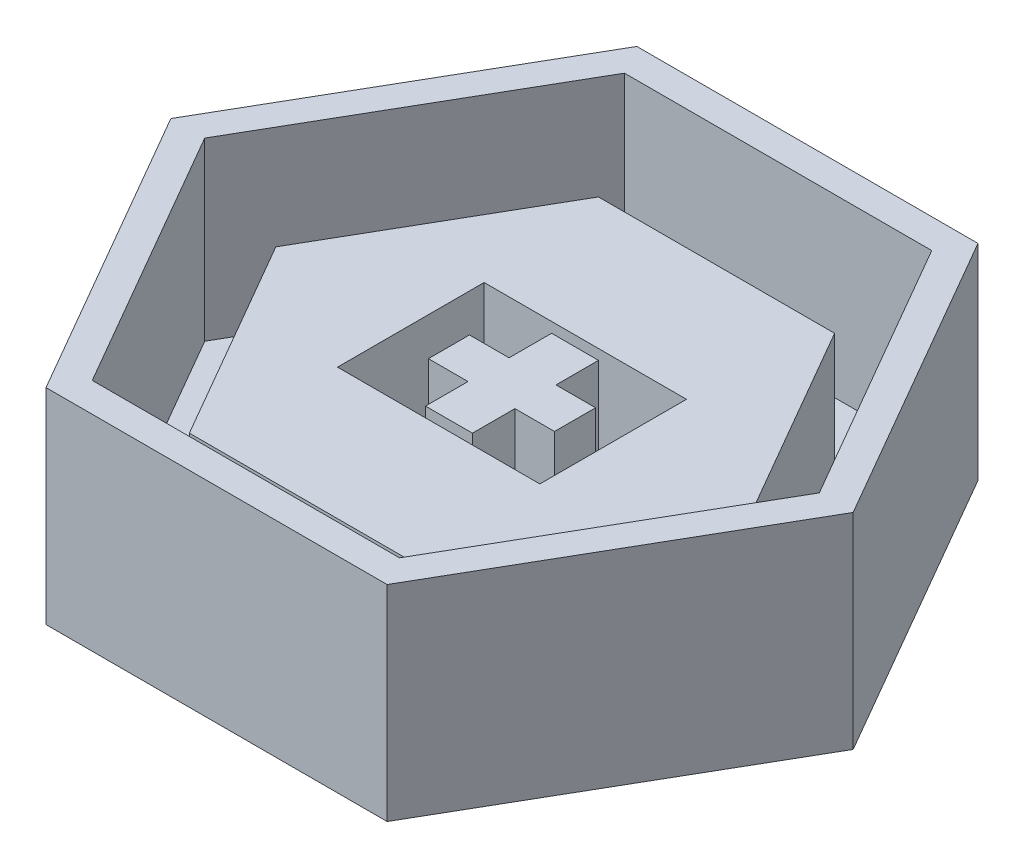
from build123d import *

# Parameters (mm, degrees)
CROSS_DEPTH         = 4
BOTTOM_DEPTH        = 1
WALLS_DEPTH         = 1
WALLS_DEPTH_BACK    = 6
SKETCH5_W           = 6.9
SKETCH5_H           = 5
BOSS_EXTRUDE4_DEPTH = 4


with BuildPart() as part:
    # Sketch1 → Cross (new body)
    with BuildSketch(Plane(origin=(0, 0, 0), x_dir=(1, 0, 0), z_dir=(0, 1, 0))):
        Polygon((-0.8, 2.15), (0.8, 2.15), (0.8, 0.7), (2.15, 0.7), (2.15, -0.7), (0.8, -0.7), (0.8, -2.15), (-0.8, -2.15), (-0.8, -0.7), (-2.15, -0.7), (-2.15, 0.7), (-0.8, 0.7), align=None)
    extrude(amount=CROSS_DEPTH)

    # Sketch3 → Bottom (add)
    with BuildSketch(Plane.XZ):
        Polygon((10.478907386, 0), (5.239453693, 9.075), (-5.239453693, 9.075), (-10.478907386, 0), (-5.239453693, -9.075), (5.239453693, -9.075), align=None)
    extrude(amount=BOTTOM_DEPTH)

    # Sketch4 → Walls (add, two sides: drawn at the far end of the back side and taken through both)
    with BuildSketch(Plane.XZ.offset(-WALLS_DEPTH_BACK)):
        Polygon((5.816803962, -10.075), (11.633607924, 0), (5.816803962, 10.075), (-5.816803962, 10.075), (-11.633607924, 0), (-5.816803962, -10.075), align=None)
        Polygon((5.239453693, -9.075), (10.478907386, 0), (5.239453693, 9.075), (-5.239453693, 9.075), (-10.478907386, 0), (-5.239453693, -9.075), align=None, mode=Mode.SUBTRACT)
    extrude(amount=WALLS_DEPTH + WALLS_DEPTH_BACK)

    # Sketch5 → Boss-Extrude4 (add)
    with BuildSketch(Plane(origin=(0, 0, 0), x_dir=(1, 0, 0), z_dir=(0, 1, 0))):
        Polygon((8.054036255, 0), (4.027018128, 6.975), (-4.027018128, 6.975), (-8.054036255, 0), (-4.027018128, -6.975), (4.027018128, -6.975), align=None)
        Rectangle(SKETCH5_W, SKETCH5_H, mode=Mode.SUBTRACT)
    extrude(amount=BOSS_EXTRUDE4_DEPTH)


solid = part.part
